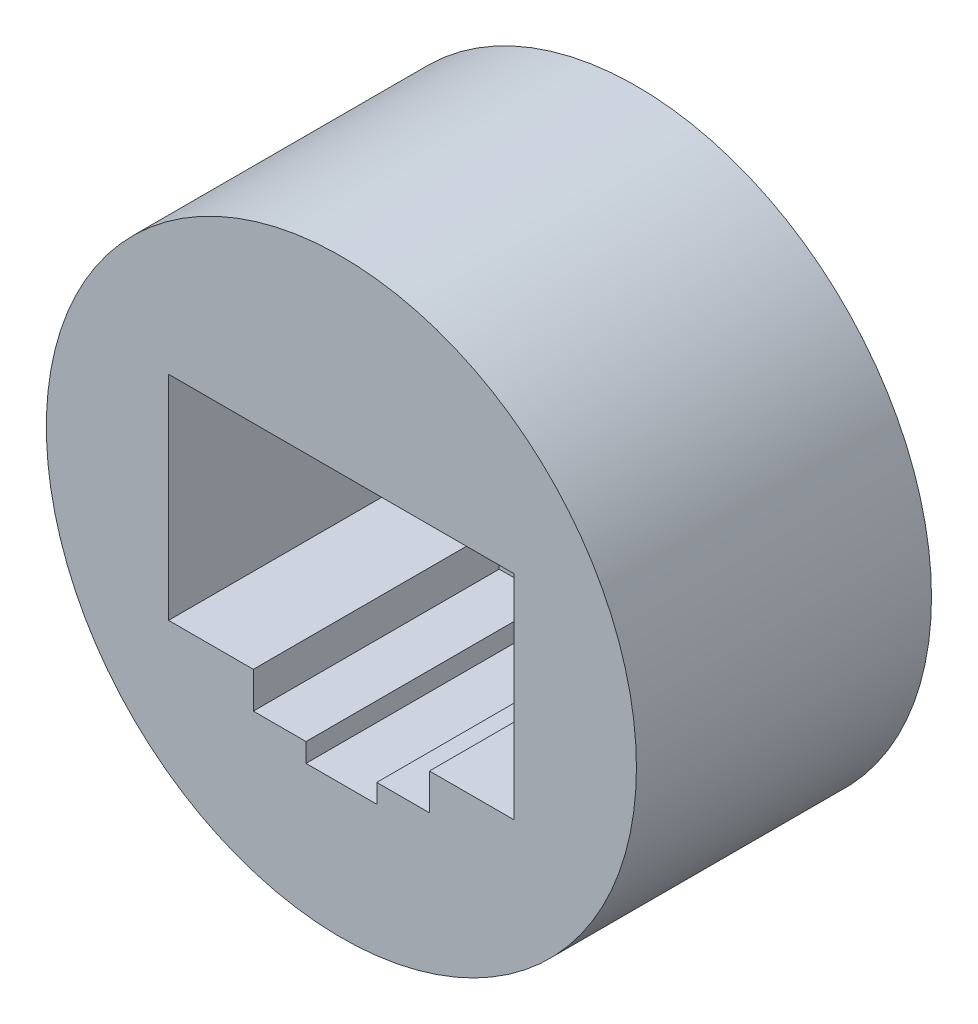
from build123d import *

# Parameters (mm, degrees)
SKETCH2_R           = 12
BOSS_EXTRUDE1_DEPTH = 12
CUT_EXTRUDE1_DEPTH  = 10


with BuildPart() as part:
    # Sketch2 → Boss-Extrude1 (new body)
    with BuildSketch(Plane.XY):
        Circle(SKETCH2_R)
    extrude(amount=BOSS_EXTRUDE1_DEPTH)

    # Sketch3 → Cut-Extrude1 (cut)
    with BuildSketch(Plane.XY.offset(12)):
        Polygon((3.581048399, -4.334317157), (7.028622417, -4.334317157), (7.028622417, 4.334317157), (-7.028622417, 4.334317157), (-7.028622417, -4.334317157), (-3.581048399, -4.334317157), (-3.581048399, -5.807105512), (-1.439194114, -5.807105512), (-1.439194114, -6.576782405), (1.439194114, -6.576782405), (1.439194114, -5.807105512), (3.581048399, -5.807105512), align=None)
    extrude(amount=-CUT_EXTRUDE1_DEPTH, mode=Mode.SUBTRACT)


solid = part.part
